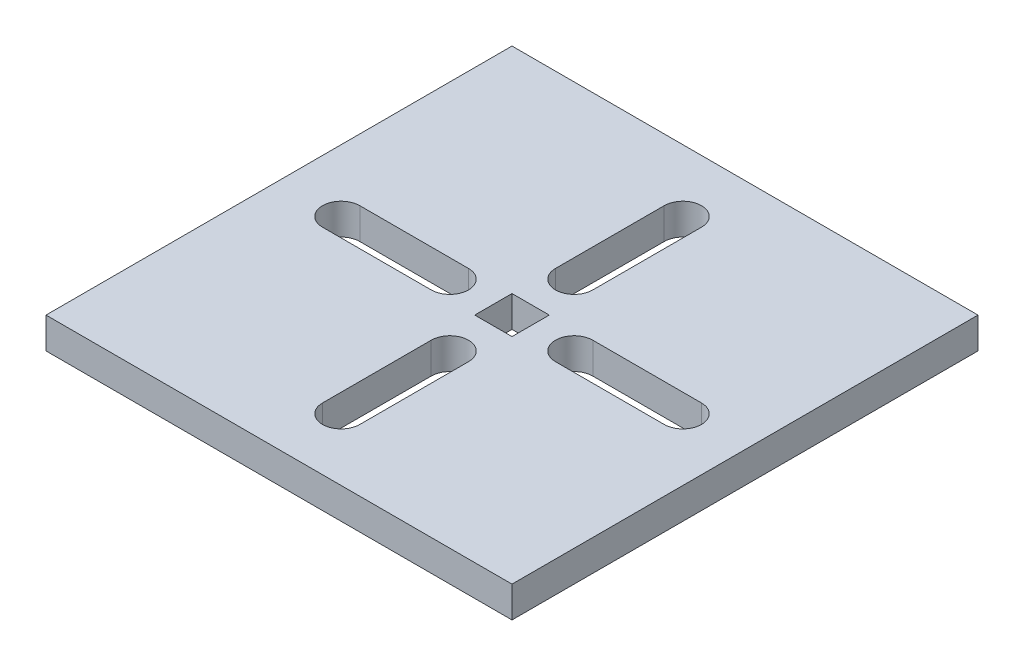
from build123d import *

# Parameters (mm, degrees)
SKETCH1_W                = 150
SKETCH1_H                = 150
BOSS_EXTRUDE1_DEPTH      = 10
SKETCH3_W                = 12
SKETCH3_H                = 12
CUT_EXTRUDE2_DEPTH       = 107.536378763
CUT_EXTRUDE1_DEPTH       = 107.536378763
PATTERN_CIRCULAR_1_COUNT = 4


with BuildPart() as part:
    # Sketch1 → Boss-Extrude1 (new body)
    with BuildSketch(Plane(origin=(0, 0, 0), x_dir=(1, 0, 0), z_dir=(0, 1, 0))):
        Rectangle(SKETCH1_W, SKETCH1_H)
    extrude(amount=BOSS_EXTRUDE1_DEPTH)

    # Sketch3 → Cut-Extrude2 (cut, through all)
    with BuildSketch(Plane(origin=(0, 10, 0), x_dir=(1, 0, 0), z_dir=(0, 1, 0))):
        Rectangle(SKETCH3_W, SKETCH3_H)
    extrude(amount=-CUT_EXTRUDE2_DEPTH, mode=Mode.SUBTRACT)

    # Sketch2 → Cut-Extrude1 (cut, through all)
    with BuildSketch(Plane(origin=(0, 10, 0), x_dir=(1, 0, 0), z_dir=(0, 1, 0))):
        with BuildLine():
            Line((20, 6), (55, 6))
            ThreePointArc((55, 6), (61, 0), (55, -6))
            Line((55, -6), (20, -6))
            ThreePointArc((20, -6), (14, 0), (20, 6))
        make_face()
    cut_extrude1 = extrude(amount=-CUT_EXTRUDE1_DEPTH, mode=Mode.SUBTRACT)

    # 環狀複製排列1: Cut-Extrude1 ×4 about axis
    pattern_circular_1_axis = Axis((0, 10.5, 0), (0, -1, 0))
    for i in range(1, PATTERN_CIRCULAR_1_COUNT):
        add(cut_extrude1.rotate(pattern_circular_1_axis, i * 360 / PATTERN_CIRCULAR_1_COUNT), mode=Mode.SUBTRACT)


solid = part.part
